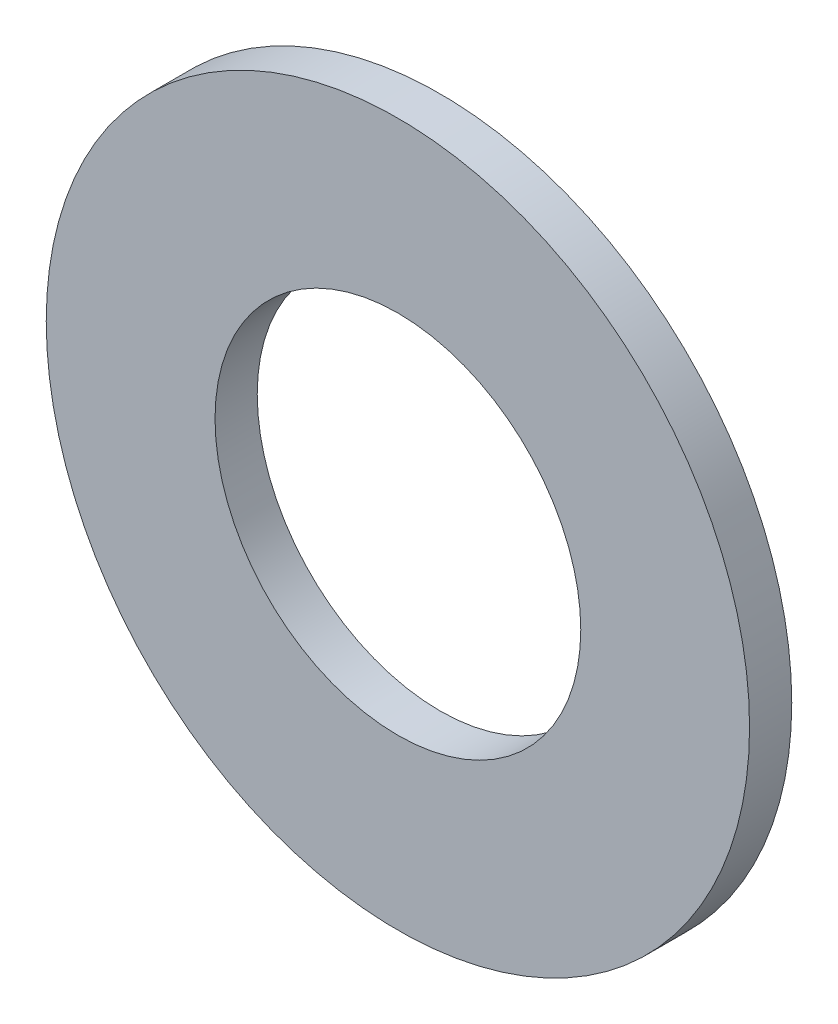
from build123d import *

# Parameters (mm, degrees)
SKETCH1_R           = 6.35
SKETCH1_R_2         = 3.302
BOSS_EXTRUDE1_DEPTH = 0.762


with BuildPart() as part:
    # Sketch1 → Boss-Extrude1 (new body)
    with BuildSketch(Plane.XY):
        Circle(SKETCH1_R)
        Circle(SKETCH1_R_2, mode=Mode.SUBTRACT)
    extrude(amount=BOSS_EXTRUDE1_DEPTH)


solid = part.part
